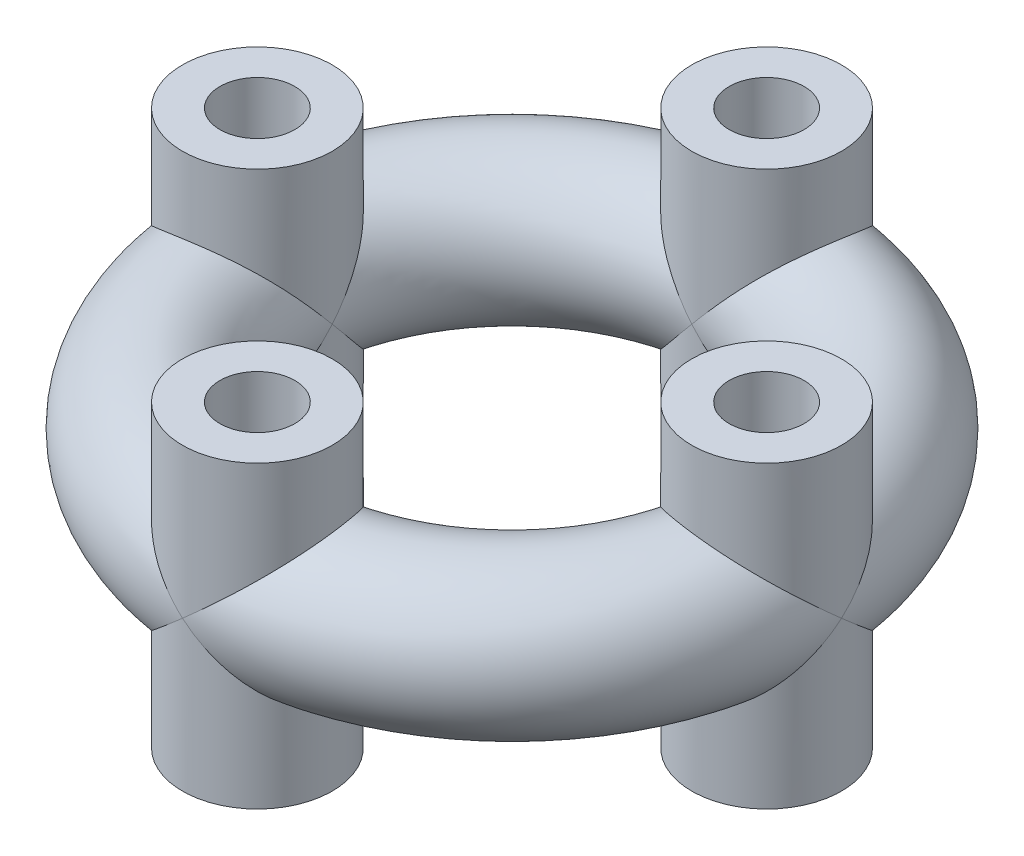
from build123d import *

# Parameters (mm, degrees)
SKETCH2_R                     = 6.35
SKETCH4_R                     = 6.35
COLUMN_DEPTH                  = 12.7
SKETCH5_R                     = 3.175
FASTENER_HOLE_CUT_DEPTH       = 42.503942147
COLUMN_AND_HOLE_PATTERN_COUNT = 4


with BuildPart() as part:
    # Sketch2 → Base Revolve (revolve)
    with BuildSketch(Plane.XY, mode=Mode.PRIVATE) as base_revolve_sk:
        with Locations((21.59, 0)):
            Circle(SKETCH2_R)
    revolve(base_revolve_sk.sketch.rotate(Axis((0, 0, 0), (0, 1, 0)), 90), axis=Axis((0, 0, 0), (0, 1, 0)))

    # Sketch4 → Column (add, symmetric)
    with BuildSketch(Plane(origin=(0, 0, 0), x_dir=(1, 0, 0), z_dir=(0, 1, 0))):
        with Locations(Location((0, 21.59, 0), (0, 0, 270))):
            Circle(SKETCH4_R)
    column = extrude(amount=COLUMN_DEPTH, both=True)

    # Sketch5 → Fastener Hole Cut (cut, symmetric)
    with BuildSketch(Plane(origin=(0, 0, 0), x_dir=(1, 0, 0), z_dir=(0, 1, 0))):
        with Locations(Location((0, 21.59, 0), (0, 0, 270))):
            Circle(SKETCH5_R)
    fastener_hole_cut = extrude(amount=FASTENER_HOLE_CUT_DEPTH, both=True, mode=Mode.SUBTRACT)

    # Column and Hole Pattern: Column, Fastener Hole Cut ×4 about axis
    column_and_hole_pattern_axis = Axis((0, 0, 0), (0, 1, 0))
    add([column.rotate(column_and_hole_pattern_axis, i * 360 / COLUMN_AND_HOLE_PATTERN_COUNT) for i in range(1, COLUMN_AND_HOLE_PATTERN_COUNT)])
    add([fastener_hole_cut.rotate(column_and_hole_pattern_axis, i * 360 / COLUMN_AND_HOLE_PATTERN_COUNT) for i in range(1, COLUMN_AND_HOLE_PATTERN_COUNT)], mode=Mode.SUBTRACT)


solid = part.part
